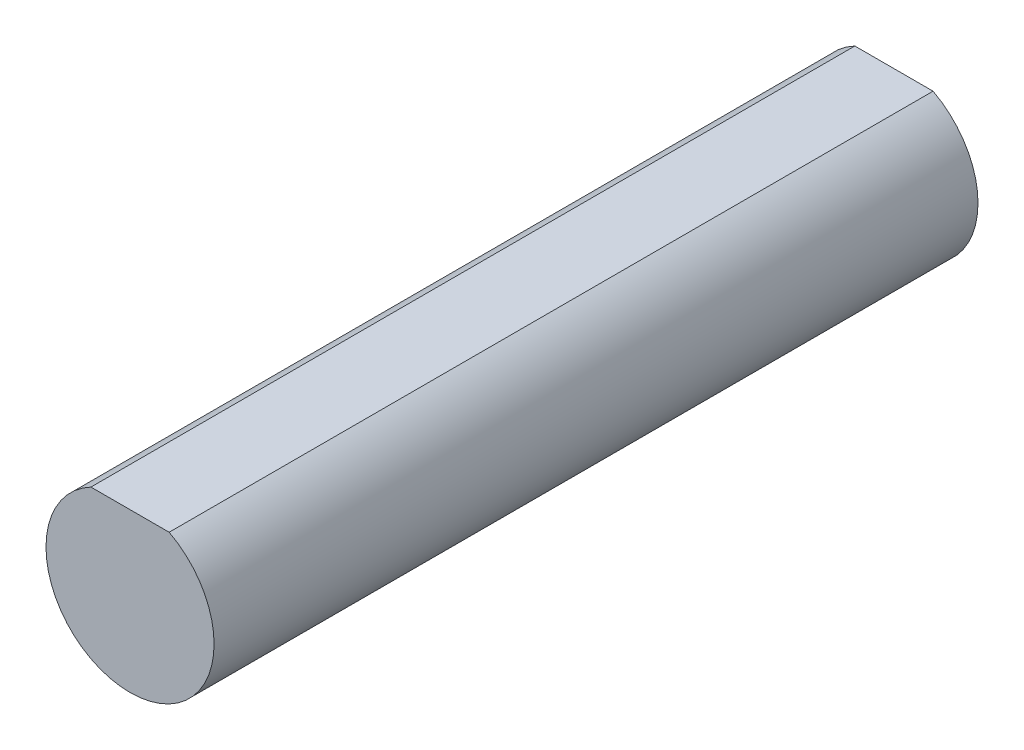
from build123d import *

# Parameters (mm, degrees)
SKETCH1_R           = 2.54
BOSS_EXTRUDE1_DEPTH = 23.0886
CUT_EXTRUDE1_DEPTH  = 23.0886


with BuildPart() as part:
    # Sketch1 → Boss-Extrude1 (new body)
    with BuildSketch(Plane.XY):
        Circle(SKETCH1_R)
        with BuildLine():
            Line((-1.182601197, 2.2479), (1.182601197, 2.2479))
            ThreePointArc((1.182601197, 2.2479), (0, 2.54), (-1.182601197, 2.2479))
        make_face()
    extrude(amount=BOSS_EXTRUDE1_DEPTH)

    # Sketch2 → Cut-Extrude1 (cut)
    with BuildSketch(Plane(origin=(0, 0, 0), x_dir=(-1, 0, 0), z_dir=(0, 0, -1))):
        with BuildLine():
            Line((-1.182601197, 2.2479), (1.182601197, 2.2479))
            ThreePointArc((1.182601197, 2.2479), (0, 2.54), (-1.182601197, 2.2479))
        make_face()
    extrude(amount=-CUT_EXTRUDE1_DEPTH, mode=Mode.SUBTRACT)


solid = part.part
